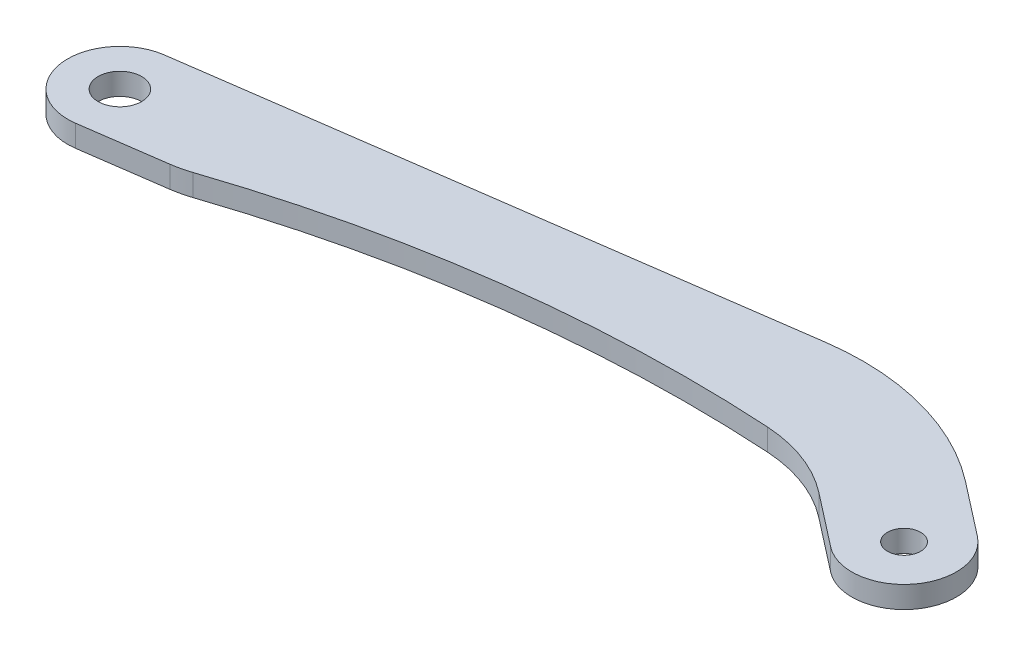
from build123d import *

# Parameters (mm, degrees)
SKETCH2_R           = 3.175
SKETCH2_R_2         = 2.413
BOSS_EXTRUDE2_DEPTH = 3.175


with BuildPart() as part:
    # Sketch2 → Boss-Extrude2 (new body)
    with BuildSketch(Plane(origin=(0, 0, 0), x_dir=(1, 0, 0), z_dir=(0, 1, 0))):
        with BuildLine():
            ThreePointArc((-57.15, -7.62), (-56.616270879, -7.601284972), (-56.085163479, -7.545231818))
            Line((-56.085163479, -7.545231818), (-44.001957312, -5.839964235))
            ThreePointArc((-44.001957312, -5.839964235), (-42.617088962, -5.579674967), (-41.261668847, -5.194386554))
            ThreePointArc((-41.261668847, -5.194386554), (-4.750522579, 3.228025881), (32.696434157, 4.541899627))
            ThreePointArc((32.696434157, 4.541899627), (39.058772614, 3.180733721), (44.734603501, 0))
            Line((44.734603501, 0), (52.473194068, -6.015969271))
            ThreePointArc((52.473194068, -6.015969271), (54.677884089, -7.207845928), (57.15, -7.62))
            ThreePointArc((57.15, -7.62), (64.357845928, -2.472115911), (61.826805932, 6.015969271))
            Line((61.826805932, 6.015969271), (54.088215365, 12.031938542))
            ThreePointArc((54.088215365, 12.031938542), (40.899560171, 18.575357931), (26.203429573, 19.458935064))
            Line((26.203429573, 19.458935064), (-58.214836521, 7.545231818))
            ThreePointArc((-58.214836521, 7.545231818), (-64.751284972, -0.533729121), (-57.15, -7.62))
        make_face()
        with Locations(Location((-57.15, 0, 0), (0, 0, 270))):
            Circle(SKETCH2_R, mode=Mode.SUBTRACT)
        with Locations(Location((57.15, 0, 0), (0, 0, 270))):
            Circle(SKETCH2_R_2, mode=Mode.SUBTRACT)
    extrude(amount=BOSS_EXTRUDE2_DEPTH)


solid = part.part
